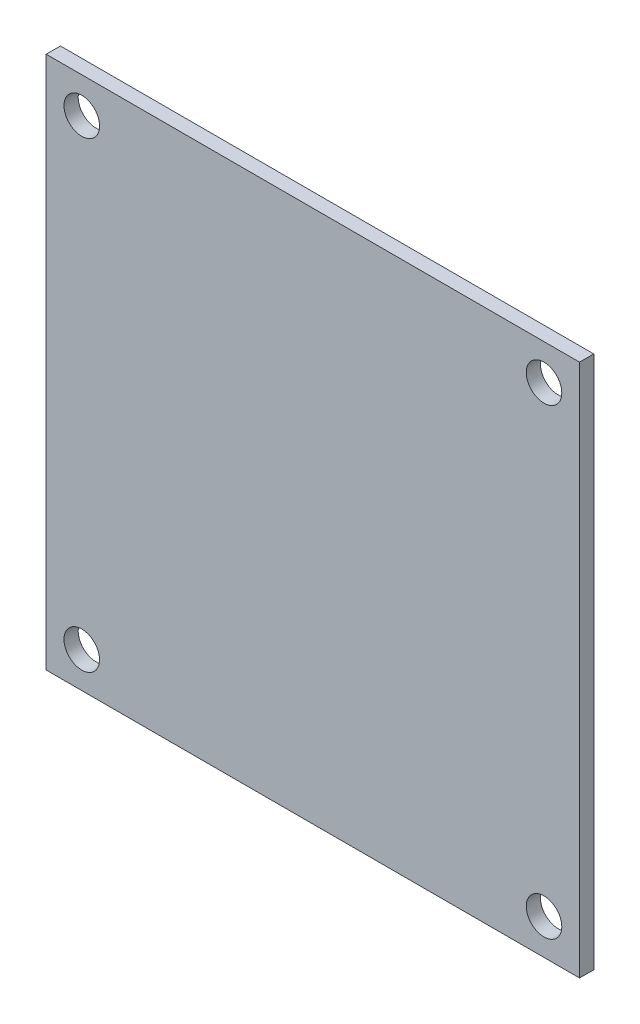
from build123d import *

# Parameters (mm, degrees)
ESQUISSE1_W             = 75
ESQUISSE1_H             = 75
BOSS_EXTRU_1_DEPTH      = 2
ESQUISSE2_R             = 2.5
ENL_V_MAT_EXTRU_1_DEPTH = 10


with BuildPart() as part:
    # Esquisse1 → Boss.-Extru.1 (new body)
    with BuildSketch(Plane.XY):
        with Locations((1.843621827, 0.675211506)):
            Rectangle(ESQUISSE1_W, ESQUISSE1_H)
    extrude(amount=BOSS_EXTRU_1_DEPTH)

    # Esquisse2 → Enlèv. mat.-Extru.1 (cut)
    with BuildSketch(Plane.XY.offset(2)):
        with Locations((-30.656378173, 33.175211506)):
            Circle(ESQUISSE2_R)
        with Locations((-30.656378173, -31.824788494)):
            Circle(ESQUISSE2_R)
        with Locations((34.343621827, 33.175211506)):
            Circle(ESQUISSE2_R)
        with Locations((34.343621827, -31.824788494)):
            Circle(ESQUISSE2_R)
    extrude(amount=-ENL_V_MAT_EXTRU_1_DEPTH, mode=Mode.SUBTRACT)


solid = part.part
